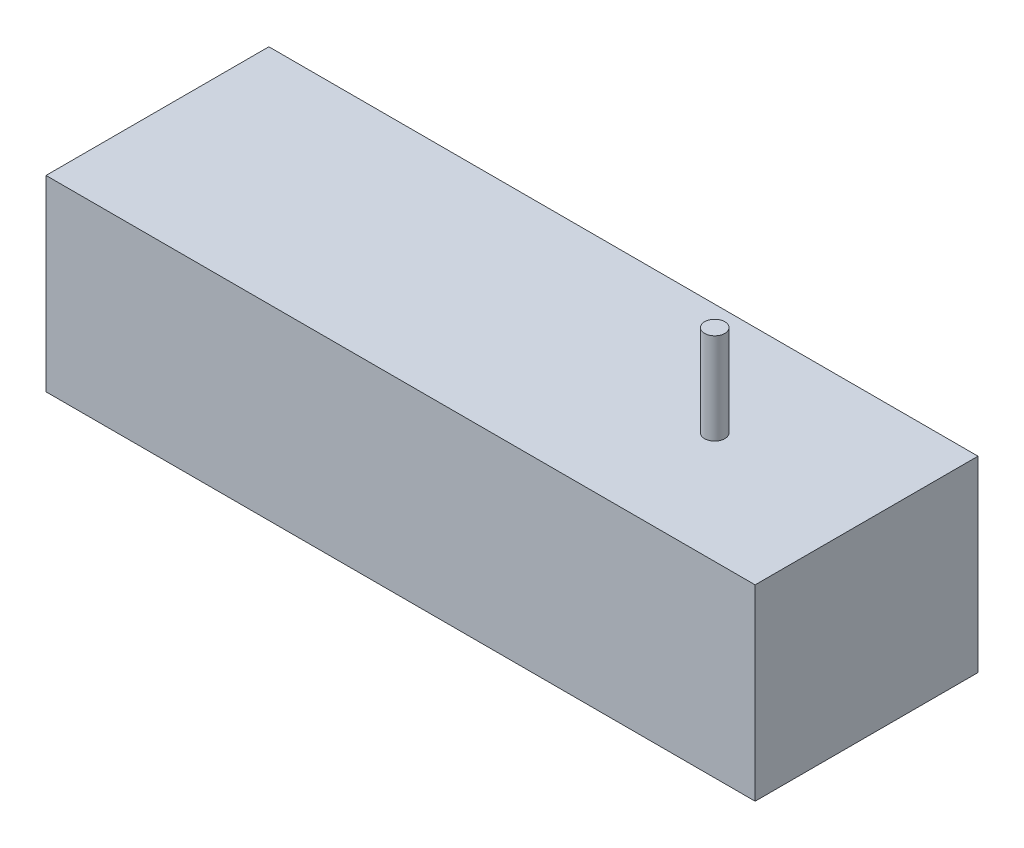
from build123d import *

# Parameters (mm, degrees)
SKETCH_2_W      = 70
SKETCH_2_H      = 22
EXTRUDE_1_DEPTH = 18.5
SKETCH_3_R      = 1
EXTRUDE_2_DEPTH = 9


with BuildPart() as part:
    # 草圖2 → 填料-伸長1 (new body)
    with BuildSketch(Plane(origin=(0, 0, 0), x_dir=(1, 0, 0), z_dir=(0, 1, 0))):
        Rectangle(SKETCH_2_W, SKETCH_2_H)
    extrude(amount=EXTRUDE_1_DEPTH)

    # 草圖3 → 填料-伸長2 (add)
    with BuildSketch(Plane(origin=(0, 18.5, 0), x_dir=(1, 0, 0), z_dir=(0, 1, 0))):
        with Locations(Location((20.011320948, 0, 0), (0, 0, 270))):
            Circle(SKETCH_3_R)
    extrude(amount=EXTRUDE_2_DEPTH)


solid = part.part
